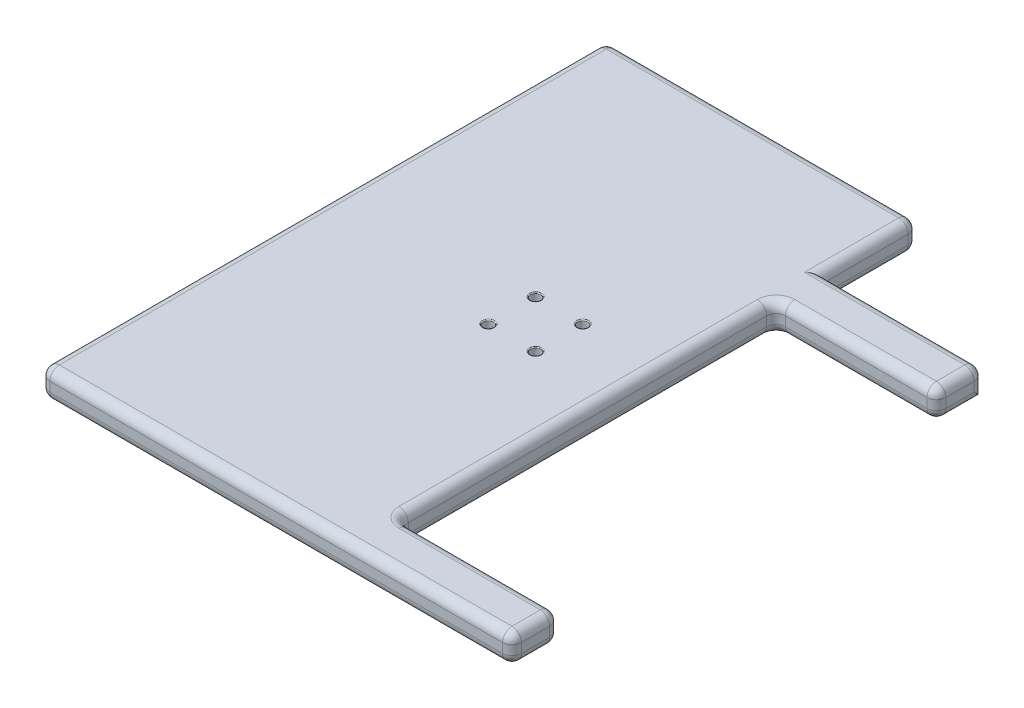
from build123d import *

# Parameters (mm, degrees)
EXTRUDE_1_DEPTH              = 6
HOLE_WIZARD_M2_1_D           = 2.2
HOLE_WIZARD_M2_1_CBORE_D     = 4.6
HOLE_WIZARD_M2_1_CBORE_DEPTH = 3
FILLET1_R                    = 2
FILLET2_R                    = 0.3
FILLET3_R                    = 0.2


with BuildPart() as part:
    # 草图1 → 凸台-拉伸1 (new body)
    with BuildSketch(Plane(origin=(0, 0, 0), x_dir=(1, 0, 0), z_dir=(0, 1, 0))):
        Polygon((-60, 60), (6, 60), (6, 40), (40, 40), (40, 30), (6, 30), (6, -50), (40, -50), (40, -60), (-60, -60), align=None)
    extrude(amount=EXTRUDE_1_DEPTH)

    # M2 六角头机械螺钉的柱形沉头孔1 (through all)
    with Locations(Plane(origin=(0, 0, 0), x_dir=(-1, 0, 0), z_dir=(0, -1, 0))):
        with Locations((10, 5), (20, 5), (20, -5), (10, -5)):
            CounterBoreHole(HOLE_WIZARD_M2_1_D / 2, HOLE_WIZARD_M2_1_CBORE_D / 2, HOLE_WIZARD_M2_1_CBORE_DEPTH)

    # Fillet1
    fillet1_edges = [part.edges().sort_by_distance(p)[0] for p in [
        (-27, 0, -60),
        (6, 0, -50),
        (40, 0, -35),
        (23, 0, -30),
        (6, 0, 10),
        (23, 0, 50),
        (40, 6, 55),
        (40, 0, 55),
        (-10, 0, 60),
        (-60, 0, 0),
        (23, 6, 50),
        (-60, 3, -60),
        (6, 3, -60),
        (40, 3, -40),
        (40, 3, -30),
        (6, 3, -30),
        (6, 3, 50),
        (40, 3, 50),
        (40, 3, 60),
        (-60, 3, 60),
        (6, 6, 10),
        (23, 6, -30),
        (40, 6, -35),
        (23, 6, -40),
        (6, 6, -50),
        (-27, 6, -60),
        (-60, 6, 0),
        (-10, 6, 60),
    ]]
    fillet(fillet1_edges, radius=FILLET1_R)

    # Fillet2
    fillet2_edges = [part.edges().sort_by_distance(p)[0] for p in [
        (-7.7, 0, 5),
        (-17.7, 0, 5),
        (-17.7, 0, -5),
        (-7.7, 0, -5),
    ]]
    fillet(fillet2_edges, radius=FILLET2_R)

    # Fillet3
    fillet3_edges = [part.edges().sort_by_distance(p)[0] for p in [
        (-11.1, 6, 5),
        (-21.1, 6, 5),
        (-21.1, 6, -5),
        (-11.1, 6, -5),
    ]]
    fillet(fillet3_edges, radius=FILLET3_R)


solid = part.part
